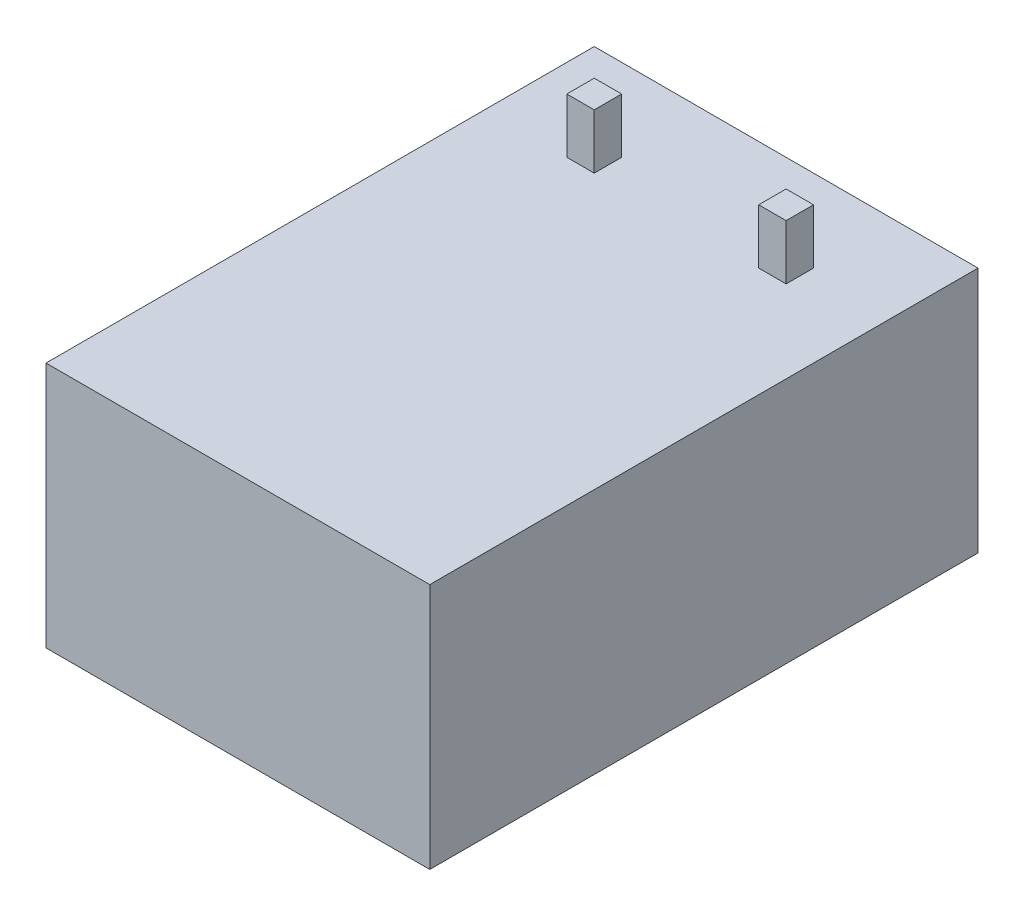
from build123d import *

# Parameters (mm, degrees)
SKETCH_1_W      = 70
SKETCH_1_H      = 100
EXTRUDE_1_DEPTH = 45
SKETCH_2_W      = 5
SKETCH_2_H      = 5
EXTRUDE_2_DEPTH = 10


with BuildPart() as part:
    # 草图1 → 凸台-拉伸1 (new body)
    with BuildSketch(Plane(origin=(0, 0, 0), x_dir=(1, 0, 0), z_dir=(0, 1, 0))):
        Rectangle(SKETCH_1_W, SKETCH_1_H)
    extrude(amount=EXTRUDE_1_DEPTH)

    # 草图2 → 凸台-拉伸2 (add)
    with BuildSketch(Plane(origin=(0, 45, 0), x_dir=(1, 0, 0), z_dir=(0, 1, 0))):
        with Locations((17.5, 32.5)):
            Rectangle(SKETCH_2_W, SKETCH_2_H)
        with Locations((-17.5, 32.5)):
            Rectangle(SKETCH_2_W, SKETCH_2_H)
    extrude(amount=EXTRUDE_2_DEPTH)


solid = part.part
